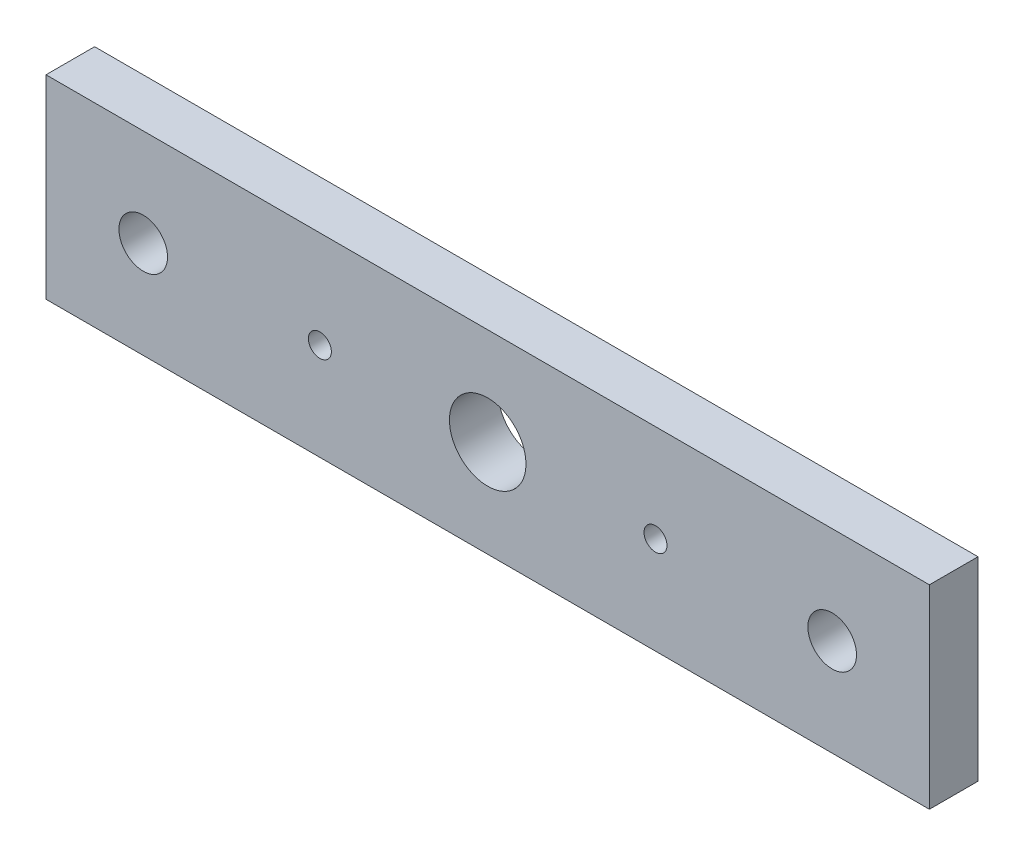
from build123d import *

# Parameters (mm, degrees)
SKETCH1_W           = 6.35
SKETCH1_H           = 25.4
BOSS_EXTRUDE1_DEPTH = 115.4
SKETCH2_R           = 5
SKETCH2_R_2         = 1.5
SKETCH2_R_3         = 3.175
CUT_EXTRUDE1_DEPTH  = 119.332761736


with BuildPart() as part:
    # Sketch1 → Boss-Extrude1 (new body)
    with BuildSketch(Plane(origin=(0, 0, 0), x_dir=(0, 0, -1), z_dir=(1, 0, 0))):
        with Locations((3.175, 12.7)):
            Rectangle(SKETCH1_W, SKETCH1_H)
    extrude(amount=BOSS_EXTRUDE1_DEPTH)

    # Sketch2 → Cut-Extrude1 (cut, through all)
    with BuildSketch(Plane.XY):
        with Locations((57.7, 12.7)):
            Circle(SKETCH2_R)
        with Locations((35.779689783, 12.7)):
            Circle(SKETCH2_R_2)
        with Locations((12.7, 12.7)):
            Circle(SKETCH2_R_3)
        with Locations((79.620310217, 12.7)):
            Circle(SKETCH2_R_2)
        with Locations((102.7, 12.7)):
            Circle(SKETCH2_R_3)
    extrude(amount=-CUT_EXTRUDE1_DEPTH, mode=Mode.SUBTRACT)


solid = part.part
